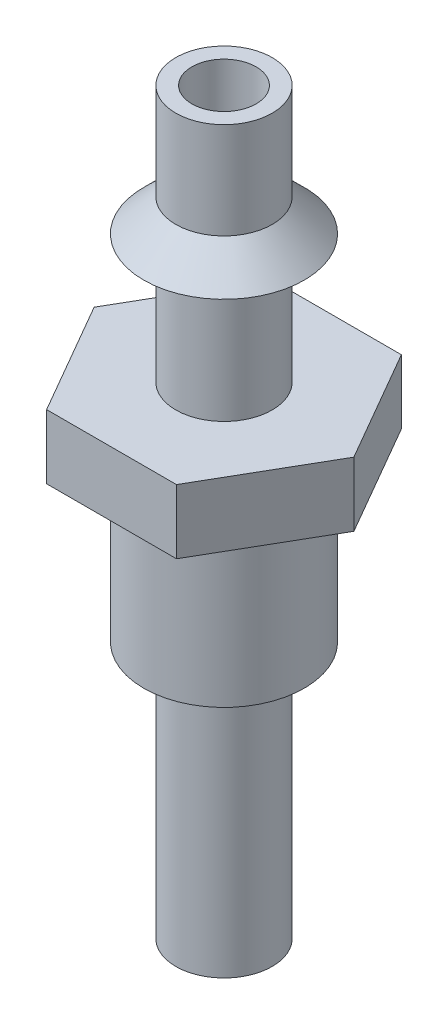
from build123d import *

# Parameters (mm, degrees)
SKETCH1_R               = 1.5
BOSS_EXTRUDE1_DEPTH     = 23
BOSS_EXTRUDE2_START     = 8
SKETCH2_R               = 2.5
BOSS_EXTRUDE2_DEPTH     = 5
BOSS_EXTRUDE3_DEPTH     = 2
BOSS_EXTRUDE4_START     = 4
SKETCH5_R               = 2.5
BOSS_EXTRUDE4_DEPTH     = 1
BOSS_EXTRUDE4_TAPER     = 45
CUT_EXTRUDE1_DEPTH      = 24.613202522
CUT_EXTRUDE1_DEPTH_BACK = 24.613202522
SKETCH6_R               = 1


with BuildPart() as part:
    # Sketch1 → Boss-Extrude1 (new body)
    with BuildSketch(Plane(origin=(0, 0, 0), x_dir=(1, 0, 0), z_dir=(0, 1, 0))):
        with Locations(Location((0, 0, 0), (0, 0, 270))):
            Circle(SKETCH1_R)
    extrude(amount=BOSS_EXTRUDE1_DEPTH)

    # Sketch2 → Boss-Extrude2 (add)
    with BuildSketch(Plane(origin=(0, 0, 0), x_dir=(1, 0, 0), z_dir=(0, 1, 0)).offset(BOSS_EXTRUDE2_START)):
        with Locations(Location((0, 0, 0), (0, 0, 270))):
            Circle(SKETCH2_R)
    extrude(amount=BOSS_EXTRUDE2_DEPTH)

    # Sketch3 → Boss-Extrude3 (add)
    with BuildSketch(Plane(origin=(0, 13, 0), x_dir=(1, 0, 0), z_dir=(0, 1, 0))):
        Polygon((-2.020725942, 3.5), (-4.041451884, 0), (-2.020725942, -3.5), (2.020725942, -3.5), (4.041451884, 0), (2.020725942, 3.5), align=None)
    extrude(amount=BOSS_EXTRUDE3_DEPTH)

    # Sketch5 → Boss-Extrude4 (add)
    with BuildSketch(Plane(origin=(0, 15, 0), x_dir=(1, 0, 0), z_dir=(0, 1, 0)).offset(BOSS_EXTRUDE4_START)):
        with Locations(Location((0, 0, 0), (0, 0, 270))):
            Circle(SKETCH5_R)
    extrude(amount=BOSS_EXTRUDE4_DEPTH, taper=BOSS_EXTRUDE4_TAPER)

    # Sketch6 → Cut-Extrude1 (cut, two sides: drawn at the far end of the back side and taken through both)
    with BuildSketch(Plane.XZ.offset(-CUT_EXTRUDE1_DEPTH_BACK)):
        with Locations(Location((0, 0, 0), (0, 0, 270))):
            Circle(SKETCH6_R)
    extrude(amount=CUT_EXTRUDE1_DEPTH + CUT_EXTRUDE1_DEPTH_BACK, mode=Mode.SUBTRACT)


solid = part.part
